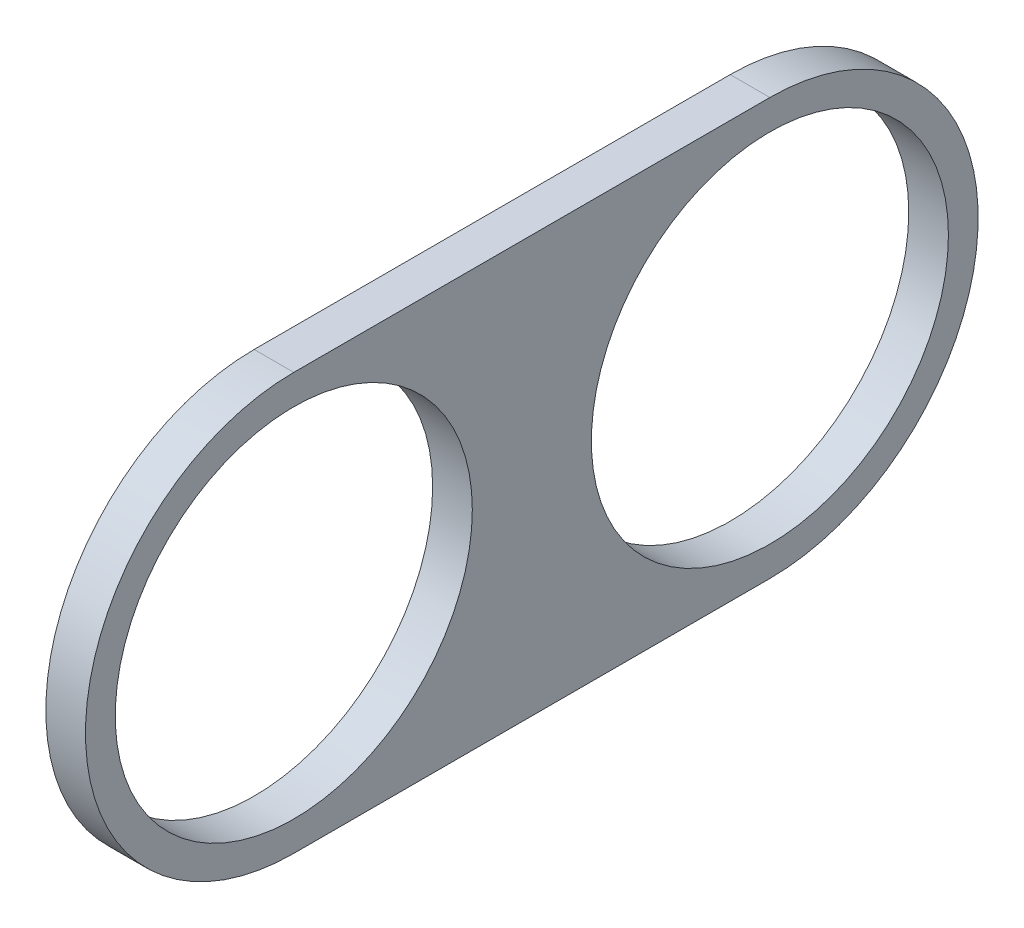
from build123d import *

# Parameters (mm, degrees)
SKETCH1_R           = 14.2875
BOSS_EXTRUDE1_DEPTH = 3.175


with BuildPart() as part:
    # Sketch1 → Boss-Extrude1 (new body)
    with BuildSketch(Plane(origin=(0, 0, 0), x_dir=(0, 0, -1), z_dir=(1, 0, 0))):
        with BuildLine():
            Line((-19.05, 16.66875), (19.05, 16.66875))
            ThreePointArc((19.05, 16.66875), (35.71875, 0), (19.05, -16.66875))
            Line((19.05, -16.66875), (-19.05, -16.66875))
            ThreePointArc((-19.05, -16.66875), (-35.71875, 0), (-19.05, 16.66875))
        make_face()
        with Locations((19.05, 0)):
            Circle(SKETCH1_R, mode=Mode.SUBTRACT)
        with Locations((-19.05, 0)):
            Circle(SKETCH1_R, mode=Mode.SUBTRACT)
    extrude(amount=BOSS_EXTRUDE1_DEPTH)


solid = part.part
